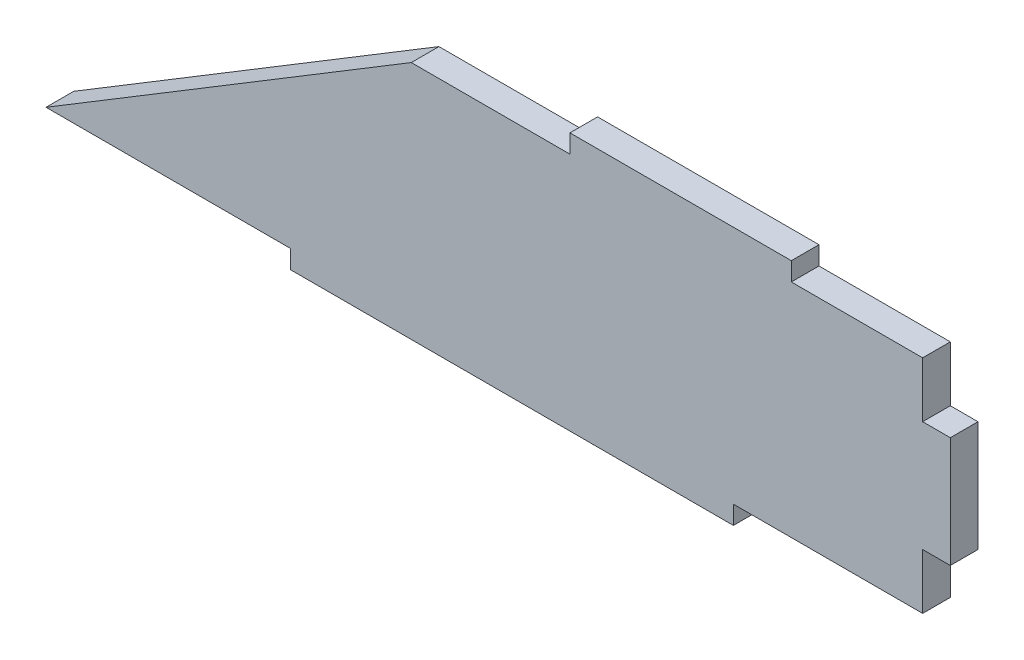
from build123d import *

# Parameters (mm, degrees)
BOSS_EXTRUDE1_DEPTH = 9.525


with BuildPart() as part:
    # Sketch1 → Boss-Extrude1 (new body)
    with BuildSketch(Plane.XY):
        Polygon((138.880411235, 35.070810918), (93.668411235, 35.070810918), (93.668411235, 41.420810918), (17.468411235, 41.420810918), (17.468411235, 35.070810918), (-37.141588765, 35.070810918), (-162.871588765, -41.129189082), (-78.670588765, -41.129189082), (-78.670588765, -47.479189082), (73.729411235, -47.479189082), (73.729411235, -41.129189082), (138.880411235, -41.129189082), (138.880411235, -22.079189082), (148.405411235, -22.079189082), (148.405411235, 16.020810918), (138.880411235, 16.020810918), align=None)
    extrude(amount=BOSS_EXTRUDE1_DEPTH)


solid = part.part
